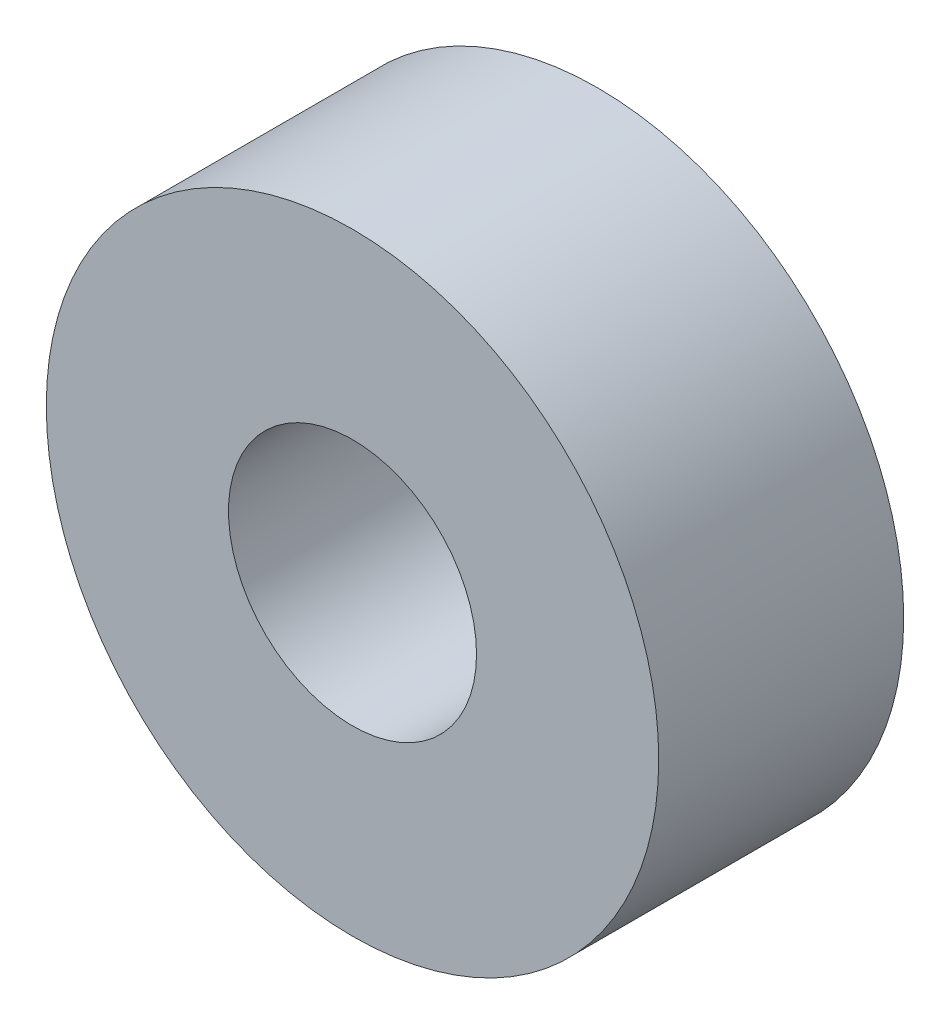
from build123d import *

# Parameters (mm, degrees)
SKETCH1_R           = 10
SKETCH1_R_2         = 4.05
BOSS_EXTRUDE1_DEPTH = 8


with BuildPart() as part:
    # Sketch1 → Boss-Extrude1 (new body)
    with BuildSketch(Plane.XY):
        Circle(SKETCH1_R)
        Circle(SKETCH1_R_2, mode=Mode.SUBTRACT)
    extrude(amount=BOSS_EXTRUDE1_DEPTH)


solid = part.part
